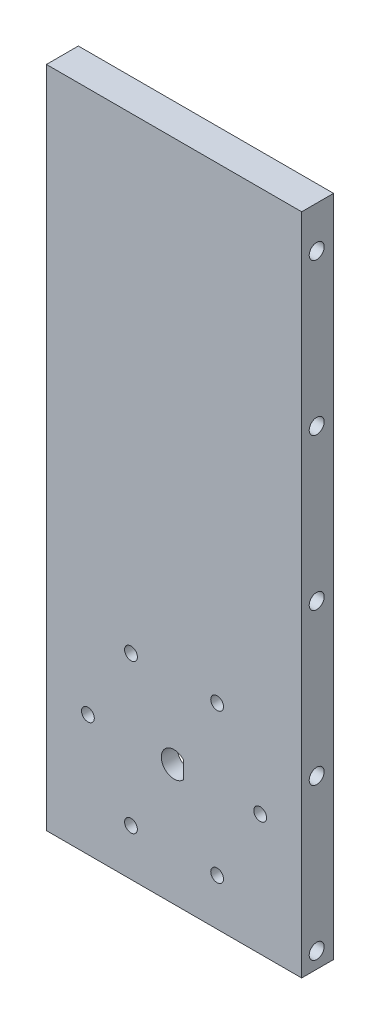
from build123d import *

# Parameters (mm, degrees)
CROQUIS1_W              = 80
CROQUIS1_H              = 200
SALIENTE_EXTRUIR1_DEPTH = 10
CORTAR_EXTRUIR1_DEPTH   = 10
CROQUIS5_R              = 2
CORTAR_EXTRUIR4_DEPTH   = 216.638586528
CROQUIS6_R              = 35
CORTAR_EXTRUIR5_DEPTH   = 5
CROQUIS7_W              = 80
CROQUIS7_H              = 8
SALIENTE_EXTRUIR2_DEPTH = 10
CROQUIS9_R              = 35
CORTAR_EXTRUIR7_DEPTH   = 5
CROQUIS11_R             = 2.35
CORTAR_EXTRUIR8_DEPTH   = 5
CROQUIS12_R             = 2.35
CORTAR_EXTRUIR9_DEPTH   = 5


with BuildPart() as part:
    # Croquis1 → Saliente-Extruir1 (new body)
    with BuildSketch(Plane.XY):
        with Locations((40, 100)):
            Rectangle(CROQUIS1_W, CROQUIS1_H)
    extrude(amount=SALIENTE_EXTRUIR1_DEPTH)

    # Croquis2 → Cortar-Extruir1 (cut)
    with BuildSketch(Plane.XY.offset(10)):
        with BuildLine():
            Line((42.90473751, 27.25), (42.90473751, 32.75))
            ThreePointArc((42.90473751, 32.75), (36, 30), (42.90473751, 27.25))
        make_face()
    extrude(amount=-CORTAR_EXTRUIR1_DEPTH, mode=Mode.SUBTRACT)

    # Croquis5 → Cortar-Extruir4 (cut, through all)
    with BuildSketch(Plane(origin=(0, 0, 0), x_dir=(-1, 0, 0), z_dir=(0, 0, -1))):
        with Locations((-13, 30)):
            Circle(CROQUIS5_R)
        with Locations((-26.5, 6.617314098)):
            Circle(CROQUIS5_R)
        with Locations((-53.5, 6.617314098)):
            Circle(CROQUIS5_R)
        with Locations((-67, 30)):
            Circle(CROQUIS5_R)
        with Locations((-53.5, 53.382685902)):
            Circle(CROQUIS5_R)
        with Locations((-26.5, 53.382685902)):
            Circle(CROQUIS5_R)
    extrude(amount=-CORTAR_EXTRUIR4_DEPTH, mode=Mode.SUBTRACT)

    # Croquis6 → Cortar-Extruir5 (cut)
    with BuildSketch(Plane(origin=(0, 0, 0), x_dir=(-1, 0, 0), z_dir=(0, 0, -1))):
        with Locations((-40, 30)):
            Circle(CROQUIS6_R)
    extrude(amount=-CORTAR_EXTRUIR5_DEPTH, mode=Mode.SUBTRACT)

    # Croquis7 → Saliente-Extruir2 (add)
    with BuildSketch(Plane.XY.offset(10)):
        with Locations((40, -4)):
            Rectangle(CROQUIS7_W, CROQUIS7_H)
    extrude(amount=-SALIENTE_EXTRUIR2_DEPTH)

    # Croquis9 → Cortar-Extruir7 (cut)
    with BuildSketch(Plane(origin=(0, 0, 0), x_dir=(-1, 0, 0), z_dir=(0, 0, -1))):
        with Locations((-40, 30)):
            Circle(CROQUIS9_R)
    extrude(amount=-CORTAR_EXTRUIR7_DEPTH, mode=Mode.SUBTRACT)

    # Croquis11 → Cortar-Extruir8 (cut)
    with BuildSketch(Plane.ZY):
        with Locations(Location((5, 187, 0), (0, 0, 270))):
            Circle(CROQUIS11_R)
        with Locations(Location((5, 139.5, 0), (0, 0, 270))):
            Circle(CROQUIS11_R)
        with Locations(Location((5, 92, 0), (0, 0, 270))):
            Circle(CROQUIS11_R)
        with Locations(Location((5, 44.5, 0), (0, 0, 270))):
            Circle(CROQUIS11_R)
        with Locations(Location((5, -3, 0), (0, 0, 270))):
            Circle(CROQUIS11_R)
    extrude(amount=-CORTAR_EXTRUIR8_DEPTH, mode=Mode.SUBTRACT)

    # Croquis12 → Cortar-Extruir9 (cut)
    with BuildSketch(Plane(origin=(80, 0, 0), x_dir=(0, 0, -1), z_dir=(1, 0, 0))):
        with Locations(Location((-5.28576423, 187, 0), (0, 0, 90))):
            Circle(CROQUIS12_R)
        with Locations(Location((-5.28576423, 139.5, 0), (0, 0, 90))):
            Circle(CROQUIS12_R)
        with Locations(Location((-5.28576423, 92, 0), (0, 0, 90))):
            Circle(CROQUIS12_R)
        with Locations(Location((-5.28576423, 44.5, 0), (0, 0, 90))):
            Circle(CROQUIS12_R)
        with Locations(Location((-5.28576423, -3, 0), (0, 0, 90))):
            Circle(CROQUIS12_R)
    extrude(amount=-CORTAR_EXTRUIR9_DEPTH, mode=Mode.SUBTRACT)


solid = part.part
